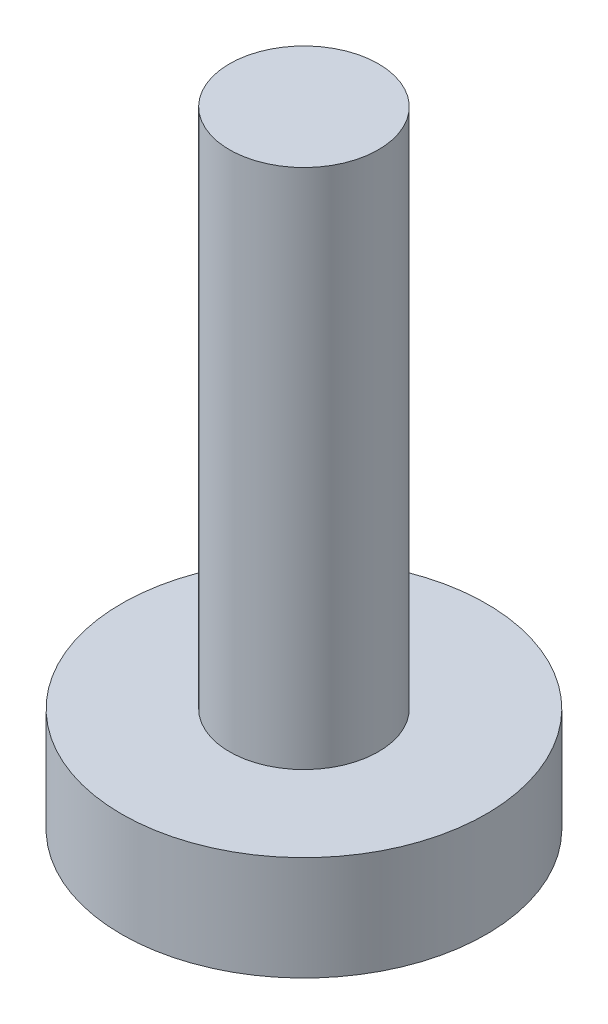
from build123d import *

# Parameters (mm, degrees)
SKETCH2_R           = 6.12
SKETCH2_R_2         = 2.5
BOSS_EXTRUDE1_DEPTH = 3.5
SKETCH2_2_R         = 2.5
BOSS_EXTRUDE2_DEPTH = 21


with BuildPart() as part:
    # Sketch2 → Boss-Extrude1 (new body)
    with BuildSketch(Plane(origin=(0, 0, 0), x_dir=(1, 0, 0), z_dir=(0, 1, 0))):
        Circle(SKETCH2_R)
        Circle(SKETCH2_R_2, mode=Mode.SUBTRACT)
    extrude(amount=BOSS_EXTRUDE1_DEPTH)

    # Sketch2<2> → Boss-Extrude2 (add)
    with BuildSketch(Plane(origin=(0, 0, 0), x_dir=(1, 0, 0), z_dir=(0, 1, 0))):
        Circle(SKETCH2_2_R)
    extrude(amount=BOSS_EXTRUDE2_DEPTH)


solid = part.part
